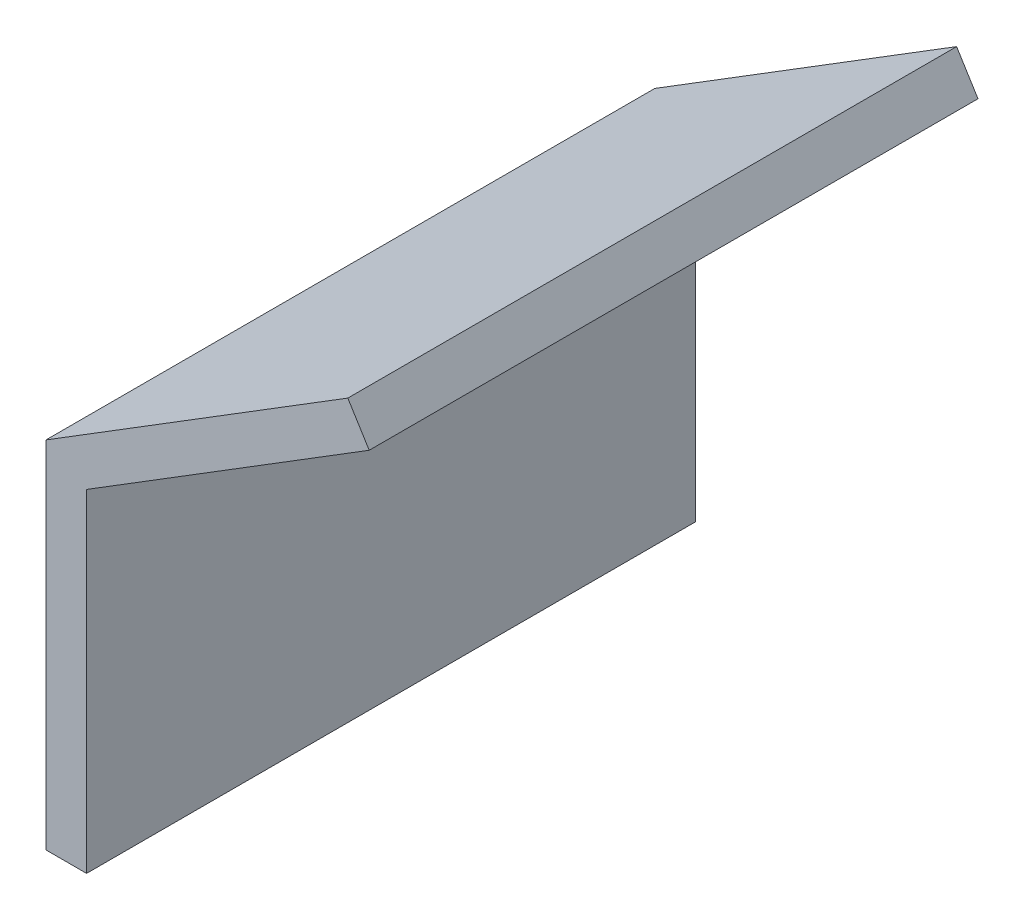
from build123d import *

# Parameters (mm, degrees)
BOSS_EXTRUDE1_DEPTH = 60


with BuildPart() as part:
    # Sketch1 → Boss-Extrude1 (new, symmetric)
    with BuildSketch(Plane.XY):
        Polygon((0, 0), (59.492488509, 36.886905685), (63.708134873, 30.087764141), (8, -4.452742878), (8, -70), (0, -70), align=None)
    extrude(amount=BOSS_EXTRUDE1_DEPTH, both=True)


solid = part.part
